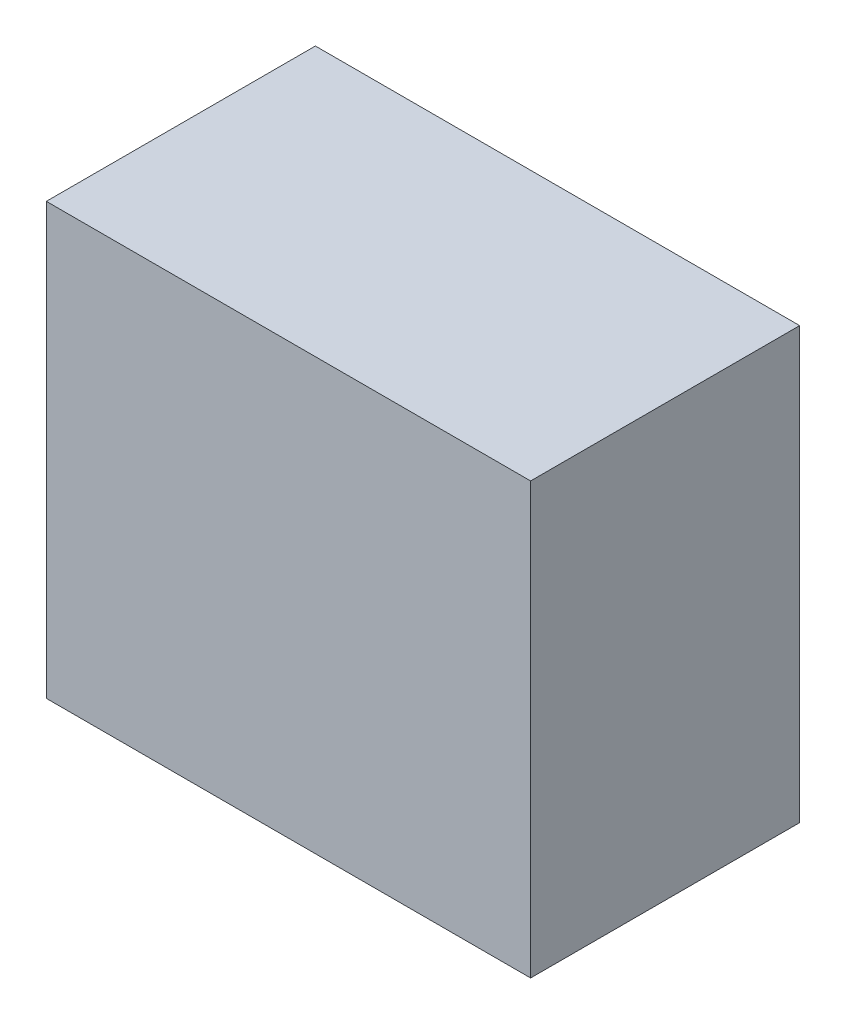
from build123d import *

# Parameters (mm, degrees)
DET2_REED_SENSOR_BRAKETI_1_START = 2
SKETCH1_W                        = 18
SKETCH1_H                        = 16
DET2_REED_SENSOR_BRAKETI_1_DEPTH = 10


with BuildPart() as part:
    # Sketch1 → DET2_reed_sensor_braketi_1 (new body)
    with BuildSketch(Plane.XY.offset(DET2_REED_SENSOR_BRAKETI_1_START)):
        with Locations((739, 1592)):
            Rectangle(SKETCH1_W, SKETCH1_H)
    extrude(amount=-DET2_REED_SENSOR_BRAKETI_1_DEPTH)


solid = part.part
